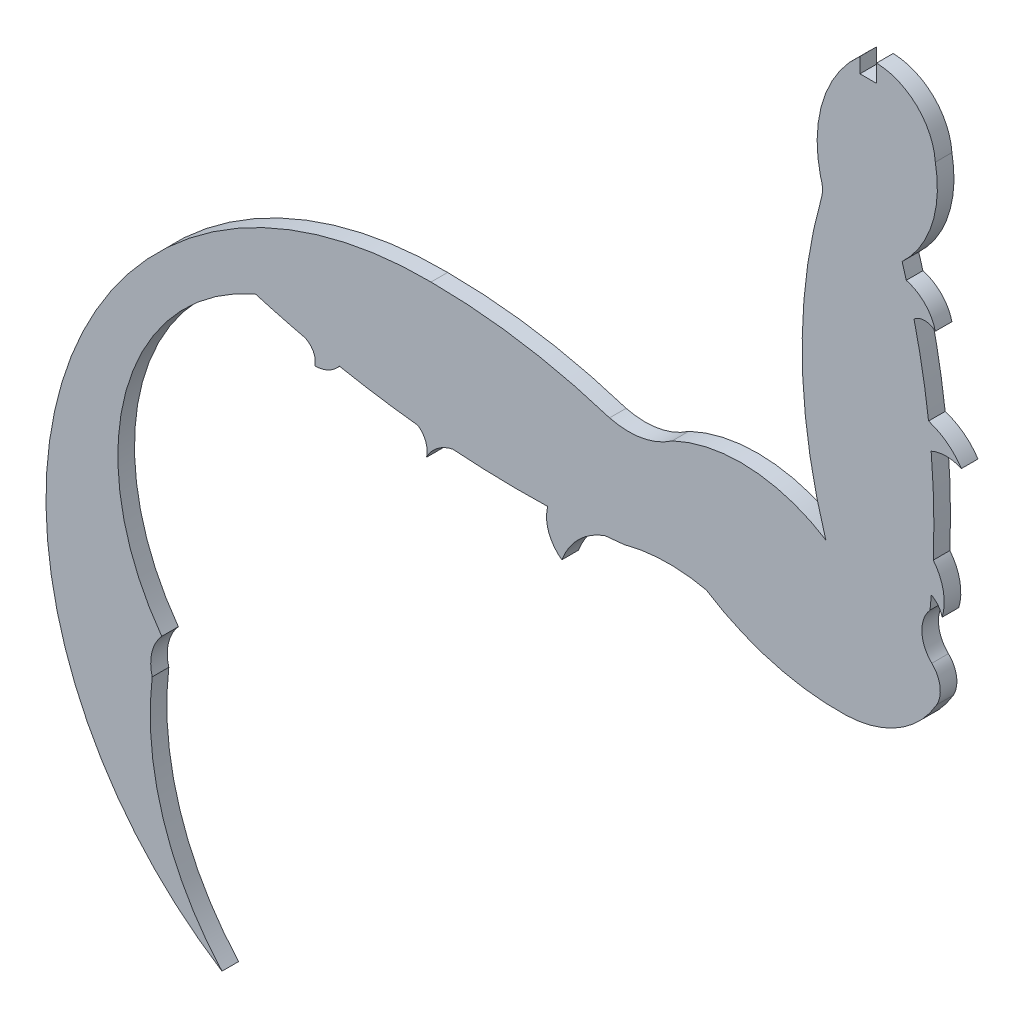
from build123d import *

# Parameters (mm, degrees)
BOSS_EXTRUDE1_DEPTH = 1.524


with BuildPart() as part:
    # Sketch1 → Boss-Extrude1 (new body)
    with BuildSketch(Plane.XY):
        with BuildLine():
            Line((-1.524, 93.996264428), (0, 93.996264428))
            Line((0, 93.996264428), (0, 95.614927588))
            ThreePointArc((0, 95.614927588), (3.693748092, 94.060684173), (5.394313408, 90.431975702))
            ThreePointArc((5.394313408, 90.431975702), (5.083870366, 85.328096728), (2.344513216, 81.010472628))
            ThreePointArc((2.344513216, 81.010472628), (2.539372179, 80.361029228), (2.727630661, 79.709641871))
            ThreePointArc((2.727630661, 79.709641871), (4.432053028, 78.713510624), (5.394313408, 76.989739169))
            ThreePointArc((5.394313408, 76.989739169), (4.415817963, 77.356115064), (3.437322519, 76.989739169))
            ThreePointArc((3.437322519, 76.989739169), (4.210597619, 73.287177771), (4.773115775, 69.546791613))
            ThreePointArc((4.773115775, 69.546791613), (6.476278237, 68.669820648), (7.786173006, 67.271959374))
            ThreePointArc((7.786173006, 67.271959374), (6.398187856, 67.566469165), (5.010202706, 67.271959374))
            ThreePointArc((5.010202706, 67.271959374), (5.244344787, 62.991455343), (5.203509677, 58.704746843))
            ThreePointArc((5.203509677, 58.704746843), (6.122995482, 56.742128292), (6.022449708, 54.577130307))
            ThreePointArc((6.022449708, 54.577130307), (5.656055769, 55.32299802), (5.02447468, 55.863061433))
            ThreePointArc((5.02447468, 55.863061433), (4.967033142, 55.219803245), (4.903376867, 54.577130307))
            ThreePointArc((4.903376867, 54.577130307), (4.160208316, 52.476052404), (5.072854771, 50.442851897))
            ThreePointArc((5.072854771, 50.442851897), (5.82334848, 48.971843275), (5.510783631, 47.350297597))
            ThreePointArc((5.510783631, 47.350297597), (1.996073925, 43.775155466), (-2.817678827, 42.374223627))
            ThreePointArc((-2.817678827, 42.374223627), (-9.49417325, 43.186036631), (-15.638900273, 45.92043747))
            ThreePointArc((-15.638900273, 45.92043747), (-19.39296862, 46.30049438), (-23.12808354, 45.765341186))
            ThreePointArc((-23.12808354, 45.765341186), (-24.022277431, 45.671562771), (-24.917397051, 45.587076243))
            ThreePointArc((-24.917397051, 45.587076243), (-27.334149164, 44.07870078), (-28.883355756, 41.687917174))
            ThreePointArc((-28.883355756, 41.687917174), (-30.089948499, 43.281908325), (-30.179098122, 45.279087881))
            ThreePointArc((-30.179098122, 45.279087881), (-34.542573171, 45.266801777), (-38.901124358, 45.474399945))
            ThreePointArc((-38.901124358, 45.474399945), (-40.315710263, 44.818959656), (-41.31100161, 43.61893866))
            ThreePointArc((-41.31100161, 43.61893866), (-41.365656867, 44.810730455), (-42.081209312, 45.765371529))
            ThreePointArc((-42.081209312, 45.765371529), (-45.704386877, 46.241994184), (-49.304220896, 46.871104556))
            ThreePointArc((-49.304220896, 46.871104556), (-50.306617349, 46.062069726), (-51.560134873, 45.765371529))
            ThreePointArc((-51.560134873, 45.765371529), (-51.69154215, 46.839952524), (-52.498251339, 47.561902989))
            ThreePointArc((-52.498251339, 47.561902989), (-54.753856575, 48.126581404), (-56.993482586, 48.751635021))
            ThreePointArc((-56.993482586, 48.751635021), (-68.899192265, 35.07600442), (-65.606179776, 17.245556751))
            ThreePointArc((-65.606179776, 17.245556751), (-66.511011599, 15.524715569), (-66.48442613, 13.580671275))
            ThreePointArc((-66.48442613, 13.580671275), (-65.472964, 2.7909779), (-60.077247453, -6.607255003))
            ThreePointArc((-60.077247453, -6.607255003), (-74.778475075, 32.819889944), (-40.89052168, 57.764477873))
            ThreePointArc((-40.89052168, 57.764477873), (-32.596685646, 57.102075632), (-24.506779764, 55.157875102))
            ThreePointArc((-24.506779764, 55.157875102), (-21.512905256, 55.048508832), (-18.750408328, 56.207756982))
            ThreePointArc((-18.750408328, 56.207756982), (-11.598379652, 57.610020261), (-4.659613728, 55.380360214))
            ThreePointArc((-4.659613728, 55.380360214), (-6.824036174, 68.85301684), (-5.055416365, 82.38332301))
            ThreePointArc((-5.055416365, 82.38332301), (-4.963334277, 83.197390982), (-5.135176923, 83.998425237))
            ThreePointArc((-5.135176923, 83.998425237), (-4.912918532, 90.191927066), (-1.524, 95.380770374))
            Line((-1.524, 95.380770374), (-1.524, 93.996264428))
        make_face()
    extrude(amount=BOSS_EXTRUDE1_DEPTH)


solid = part.part
